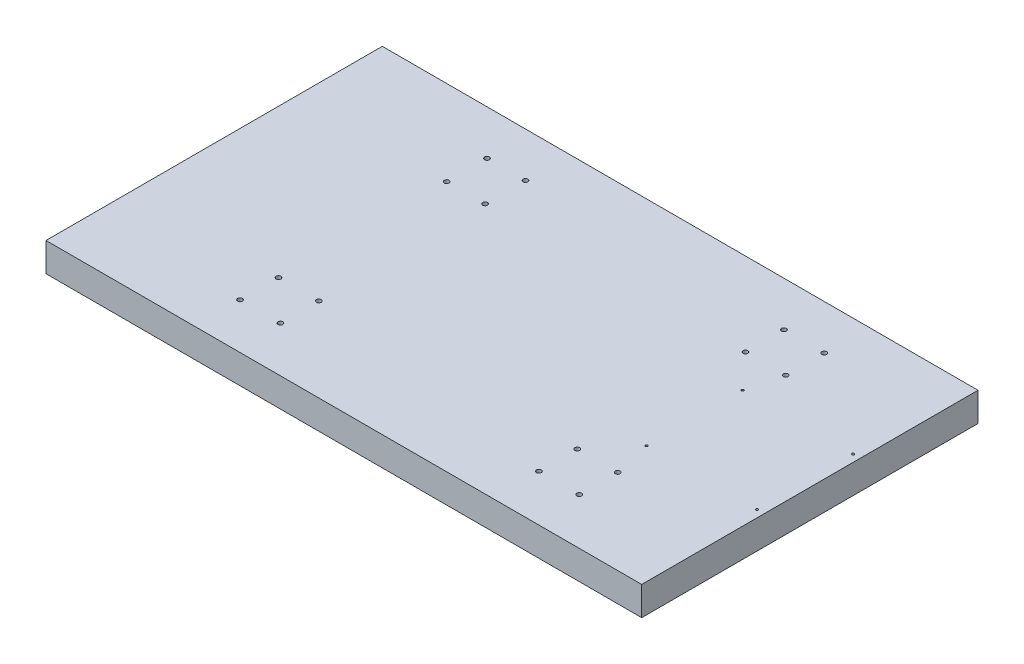
from build123d import *

# Parameters (mm, degrees)
SKETCH1_W           = 1752.6
SKETCH1_H           = 889
BOSS_EXTRUDE1_DEPTH = 76.2
SKETCH2_W           = 889
SKETCH2_H           = 76.2
BOSS_EXTRUDE2_DEPTH = 330.2
SKETCH4_W           = 889
SKETCH4_H           = 76.2
CUT_EXTRUDE1_DEPTH  = 508
SKETCH5_R           = 6.35
CUT_EXTRUDE2_DEPTH  = 73.66
SKETCH7_R           = 6.35
CUT_EXTRUDE4_DEPTH  = 40.64
SKETCH8_R           = 3.175
CUT_EXTRUDE5_DEPTH  = 44.958


with BuildPart() as part:
    # Sketch1 → Boss-Extrude1 (new body)
    with BuildSketch(Plane(origin=(0, 0, 0), x_dir=(1, 0, 0), z_dir=(0, 1, 0))):
        Rectangle(SKETCH1_W, SKETCH1_H)
    extrude(amount=BOSS_EXTRUDE1_DEPTH)

    # Sketch2 → Boss-Extrude2 (add)
    with BuildSketch(Plane.ZY.offset(876.3)):
        with Locations((0, 38.1)):
            Rectangle(SKETCH2_W, SKETCH2_H)
    extrude(amount=BOSS_EXTRUDE2_DEPTH)

    # Sketch4 → Cut-Extrude1 (cut)
    with BuildSketch(Plane(origin=(876.3, 0, 0), x_dir=(0, 0, -1), z_dir=(1, 0, 0))):
        with Locations((0, 38.1)):
            Rectangle(SKETCH4_W, SKETCH4_H)
    extrude(amount=-CUT_EXTRUDE1_DEPTH, mode=Mode.SUBTRACT)

    # Sketch5 → Cut-Extrude2 (cut)
    with BuildSketch(Plane(origin=(0, 76.2, 0), x_dir=(1, 0, 0), z_dir=(0, 1, 0))):
        with Locations(Location((-811.594063252, 219.722, 0), (0, 0, 270))):
            Circle(SKETCH5_R)
        with Locations(Location((-811.594063252, 326.402, 0), (0, 0, 270))):
            Circle(SKETCH5_R)
        with Locations(Location((-709.994063252, 326.402, 0), (0, 0, 270))):
            Circle(SKETCH5_R)
        with Locations(Location((-709.994063252, 219.722, 0), (0, 0, 270))):
            Circle(SKETCH5_R)
        with Locations(Location((-26.734063252, 326.402, 0), (0, 0, 270))):
            Circle(SKETCH5_R)
        with Locations(Location((79.945936748, 326.402, 0), (0, 0, 270))):
            Circle(SKETCH5_R)
        with Locations(Location((79.945936748, 224.802, 0), (0, 0, 270))):
            Circle(SKETCH5_R)
        with Locations(Location((-26.734063252, 224.802, 0), (0, 0, 270))):
            Circle(SKETCH5_R)
        with Locations(Location((-26.758063252, -219.722, 0), (0, 0, 270))):
            Circle(SKETCH5_R)
        with Locations(Location((79.921936748, -219.722, 0), (0, 0, 270))):
            Circle(SKETCH5_R)
        with Locations(Location((79.921936748, -321.322, 0), (0, 0, 270))):
            Circle(SKETCH5_R)
        with Locations(Location((-26.758063252, -321.322, 0), (0, 0, 270))):
            Circle(SKETCH5_R)
        with Locations(Location((-707.478063252, -222.262, 0), (0, 0, 270))):
            Circle(SKETCH5_R)
        with Locations(Location((-707.478063252, -323.862, 0), (0, 0, 270))):
            Circle(SKETCH5_R)
        with Locations(Location((-814.158063252, -323.862, 0), (0, 0, 270))):
            Circle(SKETCH5_R)
        with Locations(Location((-814.158063252, -222.262, 0), (0, 0, 270))):
            Circle(SKETCH5_R)
    extrude(amount=-CUT_EXTRUDE2_DEPTH, mode=Mode.SUBTRACT)

    # Sketch7 → Cut-Extrude4 (cut)
    with BuildSketch(Plane(origin=(0, 0, -444.5), x_dir=(-1, 0, 0), z_dir=(0, 0, -1))):
        with Locations((190.5, 38.1)):
            Circle(SKETCH7_R)
        with Locations((647.7, 38.1)):
            Circle(SKETCH7_R)
    extrude(amount=-CUT_EXTRUDE4_DEPTH, mode=Mode.SUBTRACT)

    # Sketch8 → Cut-Extrude5 (cut)
    with BuildSketch(Plane(origin=(0, 76.2, 0), x_dir=(1, 0, 0), z_dir=(0, 1, 0))):
        with Locations(Location((349.25, 133.35, 0), (0, 0, 270))):
            Circle(SKETCH8_R)
        with Locations(Location((349.25, -120.65, 0), (0, 0, 270))):
            Circle(SKETCH8_R)
        with Locations(Location((57.15, -120.65, 0), (0, 0, 270))):
            Circle(SKETCH8_R)
        with Locations(Location((57.15, 133.35, 0), (0, 0, 270))):
            Circle(SKETCH8_R)
    extrude(amount=-CUT_EXTRUDE5_DEPTH, mode=Mode.SUBTRACT)


solid = part.part
